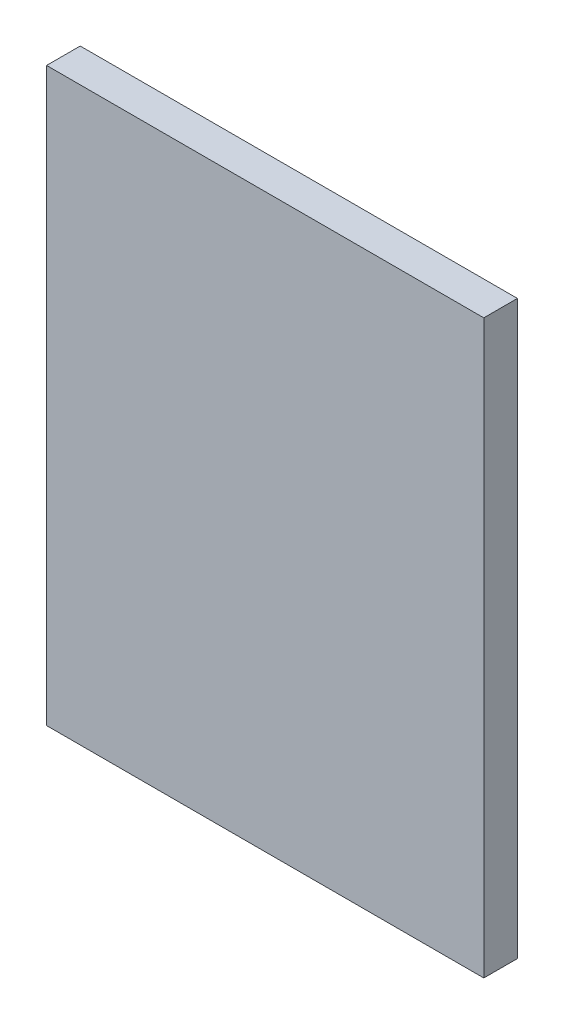
from build123d import *

# Parameters (mm, degrees)
CROQUIS1_W              = 26
CROQUIS1_H              = 34
SALIENTE_EXTRUIR1_DEPTH = 2


with BuildPart() as part:
    # Croquis1 → Saliente-Extruir1 (new body)
    with BuildSketch(Plane.XY):
        Rectangle(CROQUIS1_W, CROQUIS1_H)
    extrude(amount=SALIENTE_EXTRUIR1_DEPTH)


solid = part.part
